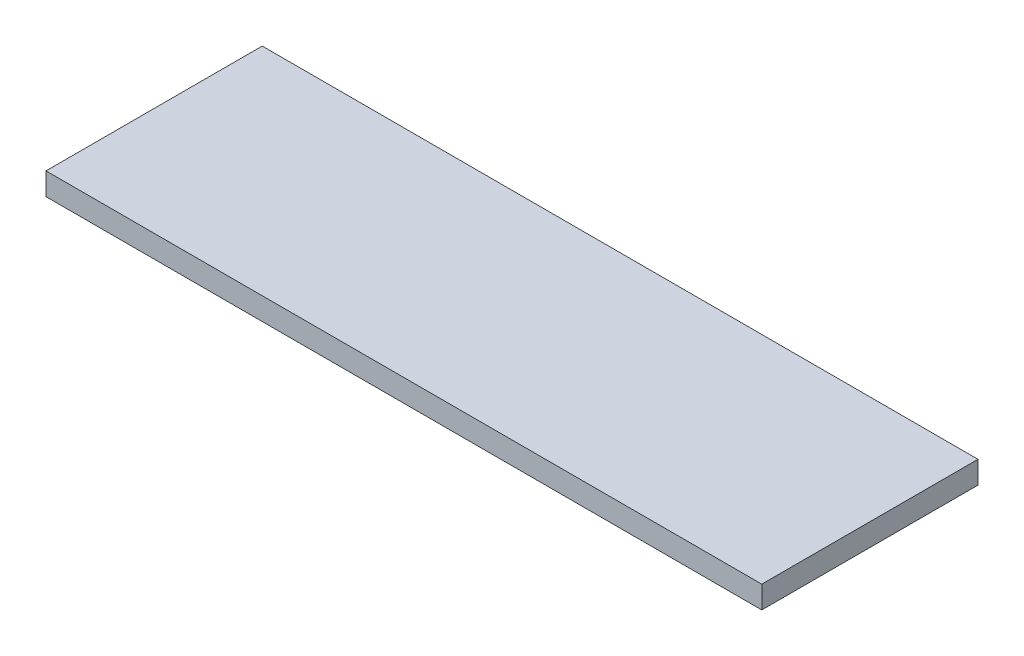
from build123d import *

# Parameters (mm, degrees)
SKETCH1_W           = 609.6
SKETCH1_H           = 184.15
BOSS_EXTRUDE1_DEPTH = 19.05


with BuildPart() as part:
    # Sketch1 → Boss-Extrude1 (new body)
    with BuildSketch(Plane(origin=(0, 0, 0), x_dir=(1, 0, 0), z_dir=(0, 1, 0))):
        Rectangle(SKETCH1_W, SKETCH1_H)
    extrude(amount=BOSS_EXTRUDE1_DEPTH)


solid = part.part
